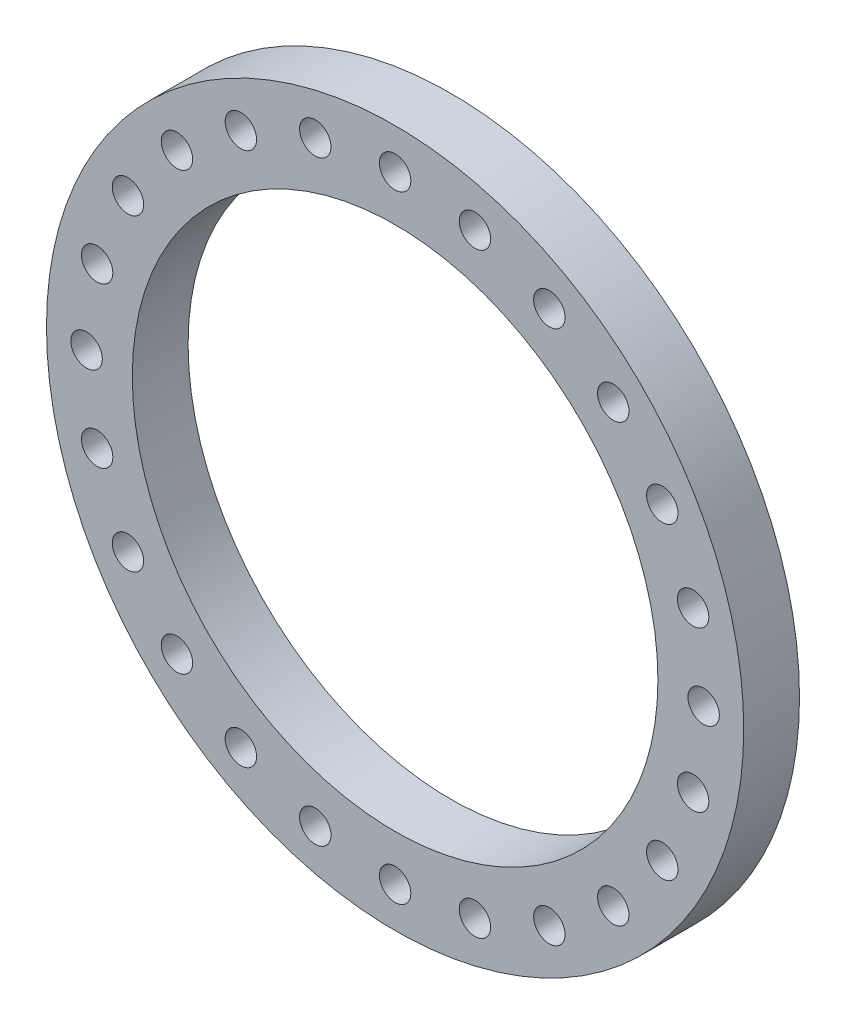
from build123d import *

# Parameters (mm, degrees)
SKETCH1_R               = 387.5
BOSS_EXTRUDE1_DEPTH     = 62
SKETCH3_R               = 17.4625
CUT_EXTRUDE1_DEPTH      = 552.503853114
SKETCH2_R               = 292.1
BOSS_EXTRUDE2_DEPTH     = 1.5
CIRPATTERN1_COUNT       = 24
CUT_EXTRUDE4_DEPTH      = 552.67449642
CUT_EXTRUDE4_DEPTH_BACK = 552.67449642
SKETCH8_R               = 292.1


with BuildPart() as part:
    # Sketch1 → Boss-Extrude1 (new body)
    with BuildSketch(Plane.XY):
        Circle(SKETCH1_R)
    extrude(amount=BOSS_EXTRUDE1_DEPTH)

    # Sketch3 → Cut-Extrude1 (cut, symmetric)
    with BuildSketch(Plane.XY.offset(62)):
        with Locations((0, 342.9)):
            Circle(SKETCH3_R)
    cut_extrude1 = extrude(amount=CUT_EXTRUDE1_DEPTH, both=True, mode=Mode.SUBTRACT)

    # Sketch2 → Boss-Extrude2 (add)
    with BuildSketch(Plane.XY.offset(62)):
        Circle(SKETCH2_R)
    extrude(amount=BOSS_EXTRUDE2_DEPTH)

    # CirPattern1: Cut-Extrude1 ×24 about axis
    cirpattern1_axis = Axis((0, 0, 0), (0, 0, 1))
    for i in range(1, CIRPATTERN1_COUNT):
        add(cut_extrude1.rotate(cirpattern1_axis, i * 360 / CIRPATTERN1_COUNT), mode=Mode.SUBTRACT)

    # Sketch8 → Cut-Extrude4 (cut, two sides: drawn at the far end of the back side and taken through both)
    with BuildSketch(Plane.XY.offset(63.5).offset(-CUT_EXTRUDE4_DEPTH_BACK)):
        Circle(SKETCH8_R)
    extrude(amount=CUT_EXTRUDE4_DEPTH + CUT_EXTRUDE4_DEPTH_BACK, mode=Mode.SUBTRACT)


solid = part.part
